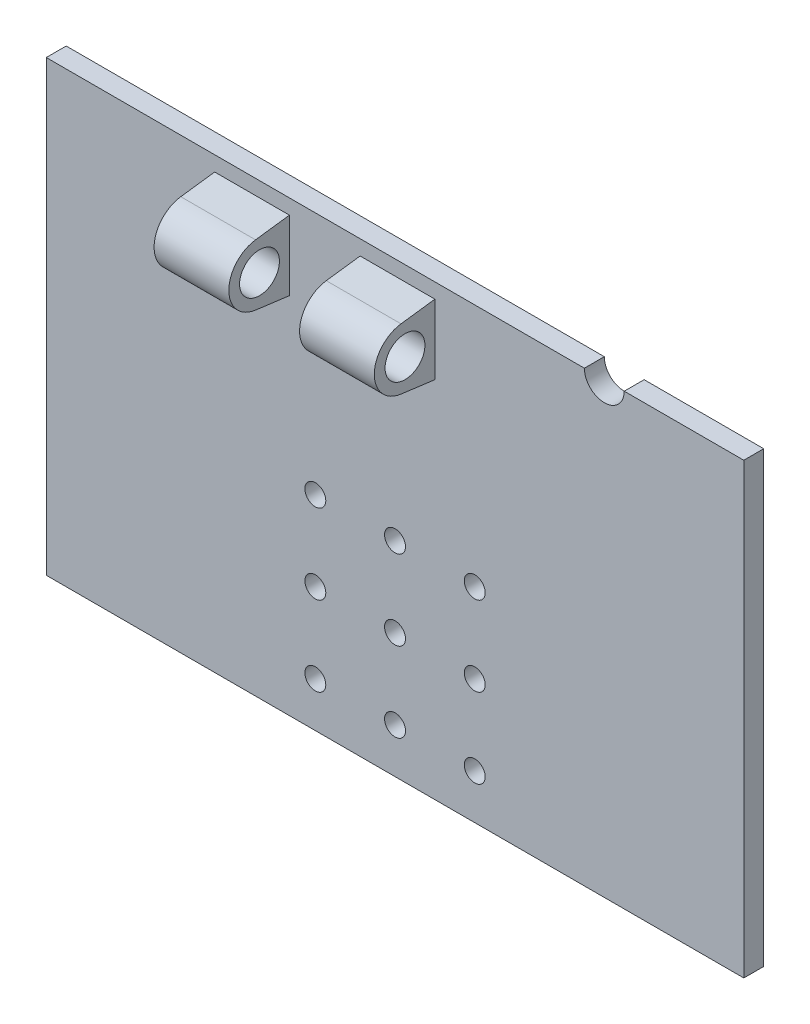
from build123d import *

# Parameters (mm, degrees)
SKETCH2_W           = 70
SKETCH2_H           = 45
BOSS_EXTRUDE1_DEPTH = 2
SKETCH3_R           = 1.05
CUT_EXTRUDE1_DEPTH  = 2
SKETCH6_R           = 2
BOSS_EXTRUDE2_DEPTH = 7.5
SKETCH4_R           = 2
CUT_EXTRUDE2_DEPTH  = 10


with BuildPart() as part:
    # Sketch2 → Boss-Extrude1 (new body)
    with BuildSketch(Plane.XY):
        with Locations((35, 22.5)):
            Rectangle(SKETCH2_W, SKETCH2_H)
    extrude(amount=BOSS_EXTRUDE1_DEPTH)

    # Sketch3 → Cut-Extrude1 (cut)
    with BuildSketch(Plane.XY.offset(2)):
        with Locations((35, 4.5)):
            Circle(SKETCH3_R)
        with Locations((43, 4.5)):
            Circle(SKETCH3_R)
        with Locations((27, 4.5)):
            Circle(SKETCH3_R)
        with Locations((27, 12.5)):
            Circle(SKETCH3_R)
        with Locations((35, 12.5)):
            Circle(SKETCH3_R)
        with Locations((43, 12.5)):
            Circle(SKETCH3_R)
        with Locations((27, 20.5)):
            Circle(SKETCH3_R)
        with Locations((35, 20.5)):
            Circle(SKETCH3_R)
        with Locations((43, 20.5)):
            Circle(SKETCH3_R)
    extrude(amount=-CUT_EXTRUDE1_DEPTH, mode=Mode.SUBTRACT)

    # Sketch6 → Boss-Extrude2 (add)
    with BuildSketch(Plane.ZY.offset(-16.9)):
        with BuildLine():
            Line((2, 43.5), (2, 36.5))
            Line((2, 36.5), (5.400666216, 36.946171815))
            ThreePointArc((5.400666216, 36.946171815), (8.08, 40), (5.400666216, 43.053828185))
            Line((5.400666216, 43.053828185), (2, 43.5))
        make_face()
        with Locations((5, 40)):
            Circle(SKETCH6_R, mode=Mode.SUBTRACT)
    boss_extrude2 = extrude(amount=-BOSS_EXTRUDE2_DEPTH)

    # Mirror4: Boss-Extrude2 across plane
    add(boss_extrude2.mirror(Plane(origin=(27.95, 0, 0), x_dir=(0, 0, 1), z_dir=(1, 0, 0))))

    # Sketch4 → Cut-Extrude2 (cut)
    with BuildSketch(Plane.XY.offset(2)):
        with Locations((56, 45)):
            Circle(SKETCH4_R)
    extrude(amount=-CUT_EXTRUDE2_DEPTH, mode=Mode.SUBTRACT)


solid = part.part
